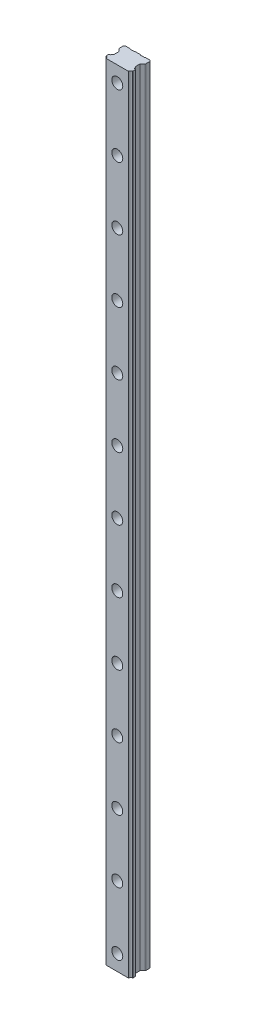
from build123d import *

# Parameters (mm, degrees)
BOSS_EXTRUDE1_DEPTH                             = 1000
CBORE_FOR_M8_SOCKET_HEAD_CAP_SCREW1_D           = 9
CBORE_FOR_M8_SOCKET_HEAD_CAP_SCREW1_CBORE_D     = 14
CBORE_FOR_M8_SOCKET_HEAD_CAP_SCREW1_CBORE_DEPTH = 12
LPATTERN1_COUNT                                 = 13
LPATTERN1_PITCH                                 = 80


with BuildPart() as part:
    # Sketch1 → Boss-Extrude1 (new body)
    with BuildSketch(Plane(origin=(0, 0, 0), x_dir=(1, 0, 0), z_dir=(0, 1, 0))):
        with BuildLine():
            Line((17, 5.931311168), (17, 3.068791187))
            ThreePointArc((17, 3.068791187), (16.928555157, 2.873769278), (16.748035952, 2.771052545))
            ThreePointArc((16.748035952, 2.771052545), (15.107380621, 1.930911566), (14.320288018, 0.264156637))
            ThreePointArc((14.320288018, 0.264156637), (14.22275768, 0.075650149), (14.024455013, 0))
            Line((14.024455013, 0), (-14.024455013, 0))
            ThreePointArc((-14.024455013, 0), (-14.22275768, 0.075650149), (-14.320288018, 0.264156637))
            ThreePointArc((-14.320288018, 0.264156637), (-15.107380621, 1.930911566), (-16.748035952, 2.771052545))
            ThreePointArc((-16.748035952, 2.771052545), (-16.928555157, 2.873769278), (-17, 3.068791187))
            Line((-17, 3.068791187), (-17, 5.931311168))
            ThreePointArc((-17, 5.931311168), (-16.929726912, 6.126665146), (-16.748035952, 6.227113532))
            ThreePointArc((-16.748035952, 6.227113532), (-15.122389411, 7.051169834), (-14.324839103, 8.689983116))
            ThreePointArc((-14.324839103, 8.689983116), (-14.296532955, 8.783889475), (-14.239451514, 8.863647545))
            Line((-14.239451514, 8.863647545), (-13.795990976, 9.307127))
            ThreePointArc((-13.795990976, 9.307127), (-13.573787196, 9.629602806), (-13.5, 10.014207298))
            Line((-13.5, 10.014207298), (-13.5, 15.081400818))
            ThreePointArc((-13.5, 15.081400818), (-13.576925545, 15.468131904), (-13.795990976, 15.795986763))
            Line((-13.795990976, 15.795986763), (-16.707107142, 18.707105901))
            ThreePointArc((-16.707107142, 18.707105901), (-16.92387963, 19.031529125), (-17, 19.414212322))
            Line((-17, 19.414212322), (-17, 24.5))
            Line((-17, 24.5), (-15.5, 26))
            Line((-15.5, 26), (-9.5, 26))
            Line((-9.5, 26), (-9.146468331, 25.64645385))
            ThreePointArc((-9.146468331, 25.64645385), (-8.984254146, 25.538062193), (-8.7929077, 25.5))
            Line((-8.7929077, 25.5), (-4.203355456, 25.5))
            ThreePointArc((-4.203355456, 25.5), (-4.013734614, 25.538090907), (-3.853533323, 25.64645385))
            Line((-3.853533323, 25.64645385), (-3.500001654, 26))
            Line((-3.500001654, 26), (3.500001654, 26))
            Line((3.500001654, 26), (3.853533323, 25.64645385))
            ThreePointArc((3.853533323, 25.64645385), (4.013734614, 25.538090907), (4.203355456, 25.5))
            Line((4.203355456, 25.5), (8.7929077, 25.5))
            ThreePointArc((8.7929077, 25.5), (8.984254146, 25.538062193), (9.146468331, 25.64645385))
            Line((9.146468331, 25.64645385), (9.5, 26))
            Line((9.5, 26), (15.5, 26))
            Line((15.5, 26), (17, 24.5))
            Line((17, 24.5), (17, 19.414212322))
            ThreePointArc((17, 19.414212322), (16.92387963, 19.031529125), (16.707107142, 18.707105901))
            Line((16.707107142, 18.707105901), (13.795990976, 15.795986763))
            ThreePointArc((13.795990976, 15.795986763), (13.576925545, 15.468131904), (13.5, 15.081400818))
            Line((13.5, 15.081400818), (13.5, 10.014207298))
            ThreePointArc((13.5, 10.014207298), (13.573787196, 9.629602806), (13.795990976, 9.307127))
            Line((13.795990976, 9.307127), (14.239451514, 8.863647545))
            ThreePointArc((14.239451514, 8.863647545), (14.296532955, 8.783889475), (14.324839103, 8.689983116))
            ThreePointArc((14.324839103, 8.689983116), (15.122389411, 7.051169834), (16.748035952, 6.227113532))
            ThreePointArc((16.748035952, 6.227113532), (16.929726912, 6.126665146), (17, 5.931311168))
        make_face()
    extrude(amount=BOSS_EXTRUDE1_DEPTH)

    # CBORE for M8 Socket Head Cap Screw1 (through all)
    with Locations(Plane.XY):
        with Locations((0, 20)):
            cbore_for_m8_socket_head_cap_screw1 = CounterBoreHole(CBORE_FOR_M8_SOCKET_HEAD_CAP_SCREW1_D / 2, CBORE_FOR_M8_SOCKET_HEAD_CAP_SCREW1_CBORE_D / 2, CBORE_FOR_M8_SOCKET_HEAD_CAP_SCREW1_CBORE_DEPTH)

    # LPattern1: CBORE for M8 Socket Head Cap Screw1 ×13
    with Locations(*[(0, i * LPATTERN1_PITCH, 0) for i in range(1, LPATTERN1_COUNT)]):
        add(cbore_for_m8_socket_head_cap_screw1, mode=Mode.SUBTRACT)


solid = part.part
